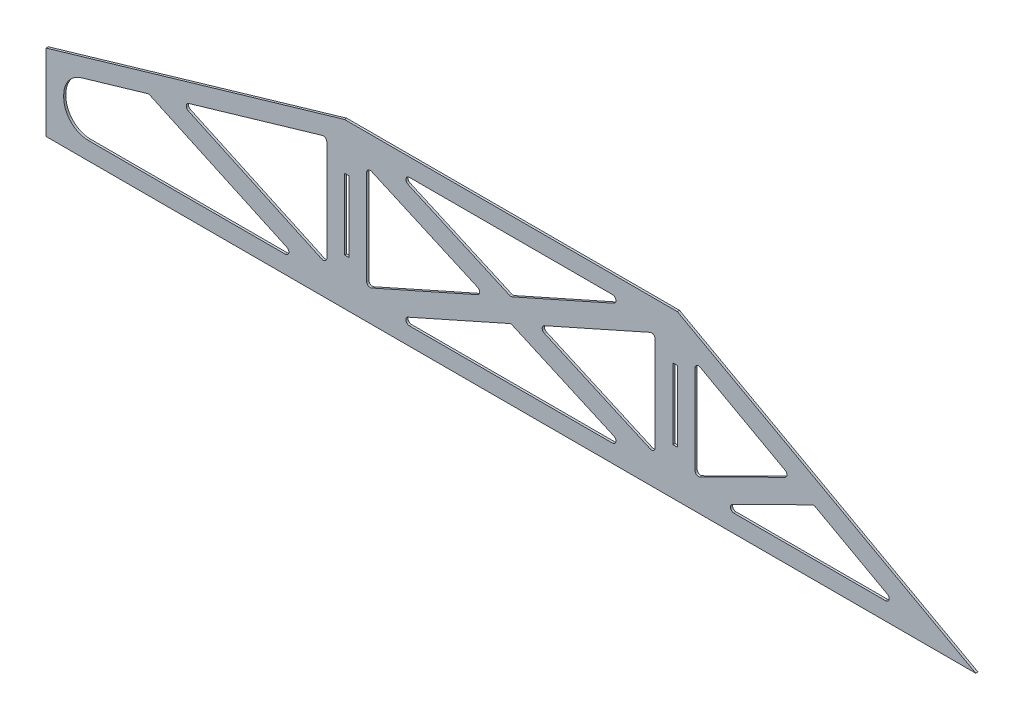
from build123d import *

# Parameters (mm, degrees)
SKETCH1_W               = 666.75
SKETCH1_H               = 117.602
BOSS_EXTRUDE1_DEPTH     = 1.5875
CUT_EXTRUDE1_REACH      = 679.044
SKETCH3_W               = 3.175
SKETCH3_H               = 50.8
CUT_EXTRUDE2_DEPTH      = 678.043804388
FILLET1_R               = 2.54
FILLET1_OF_MIRROR1_R    = 2.54
CUT_EXTRUDE3_DEPTH      = 678.043804388
CUT_EXTRUDE3_DEPTH_BACK = 678.043804388
FILLET2_R               = 2.54
CUT_EXTRUDE4_REACH      = 679.044
BOSS_EXTRUDE7_DEPTH     = 1.5875
CUT_EXTRUDE5_REACH      = 679.044
FILLET3_R               = 2.54
BOSS_EXTRUDE9_DEPTH     = 1.5875
CUT_EXTRUDE10_REACH     = 679.044
FILLET4_R               = 2.54
FILLET5_R               = 17.78


with BuildPart() as part:
    # Sketch1 → Boss-Extrude1 (new body)
    with BuildSketch(Plane.XY):
        with Locations((333.375, 58.801)):
            Rectangle(SKETCH1_W, SKETCH1_H)
    extrude(amount=BOSS_EXTRUDE1_DEPTH)

    # Sketch3 → Cut-Extrude1 (cut, up to next)
    with BuildSketch(Plane(origin=(0, 0, 0), x_dir=(-1, 0, 0), z_dir=(0, 0, -1)), mode=Mode.PRIVATE) as cut_extrude1_sk1:
        with Locations((-215.646, 58.801)):
            Rectangle(SKETCH3_W, SKETCH3_H)
    cut_extrude1_tool1 = extrude(cut_extrude1_sk1.sketch, amount=-CUT_EXTRUDE1_REACH, mode=Mode.PRIVATE) & part.part
    # Sketch3 → Cut-Extrude1 (cut, up to next)
    with BuildSketch(Plane(origin=(0, 0, 0), x_dir=(-1, 0, 0), z_dir=(0, 0, -1)), mode=Mode.PRIVATE) as cut_extrude1_sk2:
        with Locations((-451.104, 58.801)):
            Rectangle(SKETCH3_W, SKETCH3_H)
    cut_extrude1_tool2 = extrude(cut_extrude1_sk2.sketch, amount=-CUT_EXTRUDE1_REACH, mode=Mode.PRIVATE) & part.part
    # Sketch3 → Cut-Extrude1 (cut, up to next)
    with BuildSketch(Plane(origin=(0, 0, 0), x_dir=(-1, 0, 0), z_dir=(0, 0, -1)), mode=Mode.PRIVATE) as cut_extrude1_sk3:
        with Locations((-665.1625, 58.801)):
            Rectangle(SKETCH3_W, SKETCH3_H)
    cut_extrude1_tool3 = extrude(cut_extrude1_sk3.sketch, amount=-CUT_EXTRUDE1_REACH, mode=Mode.PRIVATE) & part.part
    # Sketch3 → Cut-Extrude1 (cut, up to next)
    with BuildSketch(Plane(origin=(0, 0, 0), x_dir=(-1, 0, 0), z_dir=(0, 0, -1)), mode=Mode.PRIVATE) as cut_extrude1_sk4:
        with Locations((-1.5875, 58.801)):
            Rectangle(SKETCH3_W, SKETCH3_H)
    cut_extrude1_tool4 = extrude(cut_extrude1_sk4.sketch, amount=-CUT_EXTRUDE1_REACH, mode=Mode.PRIVATE) & part.part
    add(cut_extrude1_tool1.solids().sort_by_distance((215.646, 58.801, 0))[0], mode=Mode.SUBTRACT)
    add(cut_extrude1_tool2.solids().sort_by_distance((451.104, 58.801, 0))[0], mode=Mode.SUBTRACT)
    add(cut_extrude1_tool3.solids().sort_by_distance((665.1625, 58.801, 0))[0], mode=Mode.SUBTRACT)
    add(cut_extrude1_tool4.solids().sort_by_distance((1.5875, 58.801, 0))[0], mode=Mode.SUBTRACT)

    # Sketch4 → Cut-Extrude2 (cut, symmetric)
    with BuildSketch(Plane(origin=(0, 0, 0), x_dir=(-1, 0, 0), z_dir=(0, 0, -1))):
        Polygon((-482.510180694, 104.902), (-633.756319306, 104.902), (-558.13325, 67.310525631), align=None)
        Polygon((-465.3915, 96.392474369), (-465.3915, 21.209525631), (-541.014569306, 58.801), align=None)
        Polygon((-482.510180694, 12.7), (-633.756319306, 12.7), (-558.13325, 50.291474369), align=None)
        Polygon((-650.875, 96.392474369), (-650.875, 21.209525631), (-575.251930694, 58.801), align=None)
    cut_extrude2 = extrude(amount=CUT_EXTRUDE2_DEPTH, both=True, mode=Mode.SUBTRACT)

    # Fillet1
    fillet1_edges = [part.edges().sort_by_distance(p)[0] for p in [
        (650.875, 21.209525631, 0.79375),
        (650.875, 96.392474369, 0.79375),
        (633.756319306, 12.7, 0.79375),
        (558.13325, 50.291474369, 0.79375),
        (482.510180694, 12.7, 0.79375),
        (482.510180694, 104.902, 0.79375),
        (558.13325, 67.310525631, 0.79375),
        (633.756319306, 104.902, 0.79375),
        (541.014569306, 58.801, 0.79375),
        (465.3915, 96.392474369, 0.79375),
        (465.3915, 21.209525631, 0.79375),
        (575.251930694, 58.801, 0.79375),
    ]]
    fillet(fillet1_edges, radius=FILLET1_R)

    # Mirror1: Cut-Extrude2 across plane
    add(cut_extrude2.mirror(Plane(origin=(333.375, 0, 0), x_dir=(0, 0, 1), z_dir=(1, 0, 0))), mode=Mode.SUBTRACT)

    # Fillet1 of Mirror1
    fillet1_of_mirror1_edges = [part.edges().sort_by_distance(p)[0] for p in [
        (15.875, 21.209525631, 0.79375),
        (15.875, 96.392474369, 0.79375),
        (32.993680694, 12.7, 0.79375),
        (108.61675, 50.291474369, 0.79375),
        (184.239819306, 12.7, 0.79375),
        (184.239819306, 104.902, 0.79375),
        (108.61675, 67.310525631, 0.79375),
        (32.993680694, 104.902, 0.79375),
        (125.735430694, 58.801, 0.79375),
        (201.3585, 96.392474369, 0.79375),
        (201.3585, 21.209525631, 0.79375),
        (91.498069306, 58.801, 0.79375),
    ]]
    fillet(fillet1_of_mirror1_edges, radius=FILLET1_OF_MIRROR1_R)

    # Sketch6 → Cut-Extrude3 (cut, two sides: drawn at the far end of the back side and taken through both)
    with BuildSketch(Plane(origin=(0, 0, 0), x_dir=(-1, 0, 0), z_dir=(0, 0, -1)).offset(-CUT_EXTRUDE3_DEPTH_BACK)):
        Polygon((-418.097576662, 12.7), (-248.652423338, 12.7), (-333.375, 50.458496413), align=None)
        Polygon((-436.8165, 21.042503587), (-436.8165, 96.559496413), (-352.093923338, 58.801), align=None)
        Polygon((-418.097576662, 104.902), (-248.652423338, 104.902), (-333.375, 67.143503587), align=None)
        Polygon((-229.9335, 21.042503587), (-229.9335, 96.559496413), (-314.656076662, 58.801), align=None)
    extrude(amount=CUT_EXTRUDE3_DEPTH + CUT_EXTRUDE3_DEPTH_BACK, mode=Mode.SUBTRACT)

    # Fillet2
    fillet2_edges = [part.edges().sort_by_distance(p)[0] for p in [
        (314.656076662, 58.801, 0.79375),
        (229.9335, 96.559496413, 0.79375),
        (229.9335, 21.042503587, 0.79375),
        (418.097576662, 12.7, 0.79375),
        (333.375, 50.458496413, 0.79375),
        (248.652423338, 12.7, 0.79375),
        (352.093923338, 58.801, 0.79375),
        (436.8165, 21.042503587, 0.79375),
        (436.8165, 96.559496413, 0.79375),
        (248.652423338, 104.902, 0.79375),
        (333.375, 67.143503587, 0.79375),
        (418.097576662, 104.902, 0.79375),
    ]]
    fillet(fillet2_edges, radius=FILLET2_R)

    # Sketch7 → Cut-Extrude4 (cut, up to next)
    with BuildSketch(Plane.XY.offset(1.5875), mode=Mode.PRIVATE) as cut_extrude4_sk1:
        Polygon((666.75, 0), (452.6915, 117.602), (666.75, 117.602), align=None)
    cut_extrude4_tool1 = extrude(cut_extrude4_sk1.sketch, amount=-CUT_EXTRUDE4_REACH, mode=Mode.PRIVATE) & part.part
    # Sketch7 → Cut-Extrude4 (cut, up to next)
    with BuildSketch(Plane.XY.offset(1.5875), mode=Mode.PRIVATE) as cut_extrude4_sk2:
        Polygon((0, 117.602), (0, 0), (214.0585, 117.602), align=None)
    cut_extrude4_tool2 = extrude(cut_extrude4_sk2.sketch, amount=-CUT_EXTRUDE4_REACH, mode=Mode.PRIVATE) & part.part
    add(cut_extrude4_tool1.solids().sort_by_distance((595.397167, 78.401333, 1.5875))[0], mode=Mode.SUBTRACT)
    add(cut_extrude4_tool2.solids().sort_by_distance((71.352833, 78.401333, 1.5875))[0], mode=Mode.SUBTRACT)

    # Sketch8 → Boss-Extrude7 (add)
    with BuildSketch(Plane.XY.offset(1.5875)):
        Polygon((452.6915, 117.602), (445.353295325, 104.245041059), (635.099533668, 0), (642.437738342, 13.356958941), align=None)
        Polygon((31.650466332, 0), (24.312261658, 13.356958941), (214.0585, 117.602), (221.396704675, 104.245041059), align=None)
    extrude(amount=-BOSS_EXTRUDE7_DEPTH)

    # Sketch9 → Cut-Extrude5 (cut, up to next)
    with BuildSketch(Plane.XY.offset(1.5875), mode=Mode.PRIVATE) as cut_extrude5_sk1:
        Polygon((465.3915, 92.29335713), (465.3915, 93.236214284), (465.541652204, 93.153721884), align=None)
    cut_extrude5_tool1 = extrude(cut_extrude5_sk1.sketch, amount=-CUT_EXTRUDE5_REACH, mode=Mode.PRIVATE) & part.part
    # Sketch9 → Cut-Extrude5 (cut, up to next)
    with BuildSketch(Plane.XY.offset(1.5875), mode=Mode.PRIVATE) as cut_extrude5_sk2:
        Polygon((201.3585, 93.236214284), (201.208347796, 93.153721884), (201.3585, 92.29335713), align=None)
    cut_extrude5_tool2 = extrude(cut_extrude5_sk2.sketch, amount=-CUT_EXTRUDE5_REACH, mode=Mode.PRIVATE) & part.part
    add(cut_extrude5_tool1.solids().sort_by_distance((465.441551, 92.894431, 1.5875))[0], mode=Mode.SUBTRACT)
    add(cut_extrude5_tool2.solids().sort_by_distance((201.308449, 92.894431, 1.5875))[0], mode=Mode.SUBTRACT)

    # Fillet3
    fillet3_edges = [part.edges().sort_by_distance(p)[0] for p in [
        (534.218957024, 55.422968835, 0.79375),
        (550.482067841, 46.488147941, 0.79375),
        (611.983064985, 12.7, 0.79375),
        (54.766935015, 12.7, 0.79375),
        (116.267932159, 46.488147941, 0.79375),
        (132.531042976, 55.422968835, 0.79375),
        (465.3915, 93.236214284, 0.79375),
        (201.3585, 93.236214284, 0.79375),
    ]]
    fillet(fillet3_edges, radius=FILLET3_R)

    # Sketch13 → Boss-Extrude9 (add)
    with BuildSketch(Plane.XY.offset(1.5875)):
        Polygon((0, 54.934886574), (214.0585, 117.602), (214.0585, 0), (0, 0), align=None)
    extrude(amount=-BOSS_EXTRUDE9_DEPTH)

    # Sketch14 → Cut-Extrude10 (cut, up to next)
    with BuildSketch(Plane.XY.offset(1.5875), mode=Mode.PRIVATE) as cut_extrude10_sk1:
        Polygon((201.3585, 21.092638086), (95.893254571, 69.77525285), (201.3585, 100.650936356), align=None)
    cut_extrude10_tool1 = extrude(cut_extrude10_sk1.sketch, amount=-CUT_EXTRUDE10_REACH, mode=Mode.PRIVATE) & part.part
    # Sketch14 → Cut-Extrude10 (cut, up to next)
    with BuildSketch(Plane.XY.offset(1.5875), mode=Mode.PRIVATE) as cut_extrude10_sk2:
        Polygon((73.642109065, 63.261075374), (183.176821801, 12.7), (12.7, 12.7), (12.7, 45.419849442), align=None)
    cut_extrude10_tool2 = extrude(cut_extrude10_sk2.sketch, amount=-CUT_EXTRUDE10_REACH, mode=Mode.PRIVATE) & part.part
    add(cut_extrude10_tool1.solids().sort_by_distance((166.203418, 63.839609, 1.5875))[0], mode=Mode.SUBTRACT)
    add(cut_extrude10_tool2.solids().sort_by_distance((79.163512, 31.602776, 1.5875))[0], mode=Mode.SUBTRACT)

    # Fillet4
    fillet4_edges = [part.edges().sort_by_distance(p)[0] for p in [
        (201.3585, 100.650936356, 0.79375),
        (201.3585, 21.092638086, 0.79375),
        (95.893254571, 69.77525285, 0.79375),
        (73.642109065, 63.261075374, 0.79375),
        (183.176821801, 12.7, 0.79375),
    ]]
    fillet(fillet4_edges, radius=FILLET4_R)

    # Fillet5
    fillet5_edges = [part.edges().sort_by_distance(p)[0] for p in [
        (12.7, 45.419849442, 0.79375),
        (12.7, 12.7, 0.79375),
    ]]
    fillet(fillet5_edges, radius=FILLET5_R)


solid = part.part
